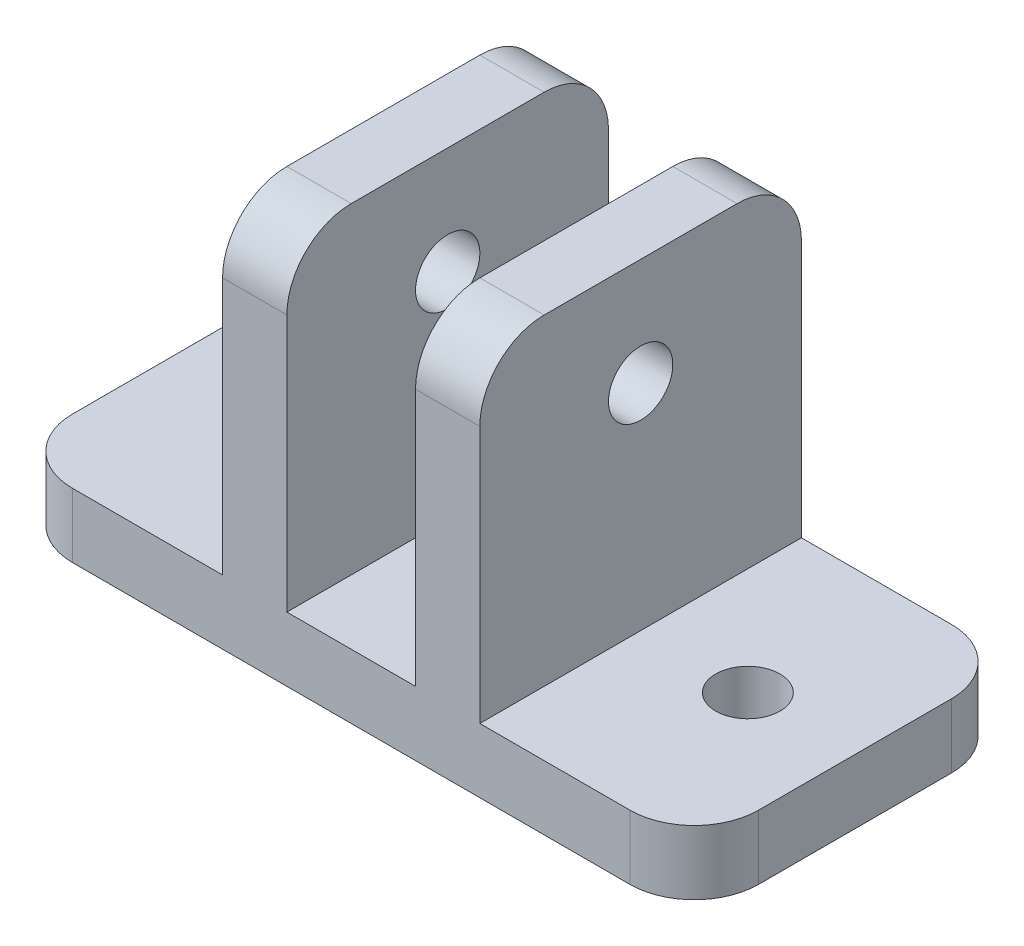
from build123d import *

# Parameters (mm, degrees)
CROQUIS1_W              = 38
CROQUIS1_H              = 15
SALIENTE_EXTRUIR1_DEPTH = 3
CROQUIS2_W              = 3
CROQUIS2_H              = 15
SALIENTE_EXTRUIR2_DEPTH = 15
CROQUIS3_W              = 6
CROQUIS3_H              = 15
CORTAR_EXTRUIR1_DEPTH   = 15
CORTAR_EXTRUIR2_DEPTH   = 15
CORTAR_EXTRUIR3_DEPTH   = 15
CROQUIS6_R              = 1.5
CORTAR_EXTRUIR4_DEPTH   = 15
CROQUIS7_R              = 1.5
CORTAR_EXTRUIR5_DEPTH   = 15


with BuildPart() as part:
    # Croquis1 → Saliente-Extruir1 (new body)
    with BuildSketch(Plane(origin=(0, 0, 0), x_dir=(1, 0, 0), z_dir=(0, 1, 0))):
        Rectangle(CROQUIS1_W, CROQUIS1_H)
    extrude(amount=SALIENTE_EXTRUIR1_DEPTH)

    # Croquis2 → Saliente-Extruir2 (add)
    with BuildSketch(Plane(origin=(0, 3, 0), x_dir=(1, 0, 0), z_dir=(0, 1, 0))):
        with Locations((-7.5, 0)):
            Rectangle(CROQUIS2_W, CROQUIS2_H)
        with Locations((1.5, 0)):
            Rectangle(CROQUIS2_W, CROQUIS2_H)
    extrude(amount=SALIENTE_EXTRUIR2_DEPTH)

    # Croquis3 → Cortar-Extruir1 (cut)
    with BuildSketch(Plane(origin=(0, 3, 0), x_dir=(1, 0, 0), z_dir=(0, 1, 0))):
        with Locations((16, 0)):
            Rectangle(CROQUIS3_W, CROQUIS3_H)
    extrude(amount=-CORTAR_EXTRUIR1_DEPTH, mode=Mode.SUBTRACT)

    # Croquis4 → Cortar-Extruir2 (cut)
    with BuildSketch(Plane(origin=(0, 3, 0), x_dir=(1, 0, 0), z_dir=(0, 1, 0))):
        with BuildLine():
            Line((-19, 7.5), (-19, 4.5))
            ThreePointArc((-19, 4.5), (-18.121320344, 6.621320344), (-16, 7.5))
            Line((-16, 7.5), (-19, 7.5))
        make_face()
        with BuildLine():
            ThreePointArc((-16, -7.5), (-18.121320344, -6.621320344), (-19, -4.5))
            Line((-19, -4.5), (-19, -7.5))
            Line((-19, -7.5), (-16, -7.5))
        make_face()
        with BuildLine():
            Line((13, -4.5), (13, -7.5))
            Line((13, -7.5), (10, -7.5))
            ThreePointArc((10, -7.5), (12.121320344, -6.621320344), (13, -4.5))
        make_face()
        with BuildLine():
            Line((10, 7.5), (13, 7.5))
            Line((13, 7.5), (13, 4.5))
            ThreePointArc((13, 4.5), (12.121320344, 6.621320344), (10, 7.5))
        make_face()
    extrude(amount=-CORTAR_EXTRUIR2_DEPTH, mode=Mode.SUBTRACT)

    # Croquis5 → Cortar-Extruir3 (cut)
    with BuildSketch(Plane.ZY.offset(9)):
        with BuildLine():
            Line((-4.5, 18), (-7.5, 18))
            Line((-7.5, 18), (-7.5, 15))
            ThreePointArc((-7.5, 15), (-6.621320344, 17.121320344), (-4.5, 18))
        make_face()
        with BuildLine():
            Line((4.5, 18), (7.5, 18))
            Line((7.5, 18), (7.5, 15))
            ThreePointArc((7.5, 15), (6.621320344, 17.121320344), (4.5, 18))
        make_face()
    extrude(amount=-CORTAR_EXTRUIR3_DEPTH, mode=Mode.SUBTRACT)

    # Croquis6 → Cortar-Extruir4 (cut)
    with BuildSketch(Plane.ZY.offset(9)):
        with Locations((0, 13)):
            Circle(CROQUIS6_R)
    extrude(amount=-CORTAR_EXTRUIR4_DEPTH, mode=Mode.SUBTRACT)

    # Croquis7 → Cortar-Extruir5 (cut)
    with BuildSketch(Plane(origin=(0, 3, 0), x_dir=(1, 0, 0), z_dir=(0, 1, 0))):
        with Locations(Location((-14, 0, 0), (0, 0, 270))):
            Circle(CROQUIS7_R)
        with Locations(Location((8, 0, 0), (0, 0, 270))):
            Circle(CROQUIS7_R)
    extrude(amount=-CORTAR_EXTRUIR5_DEPTH, mode=Mode.SUBTRACT)


solid = part.part
